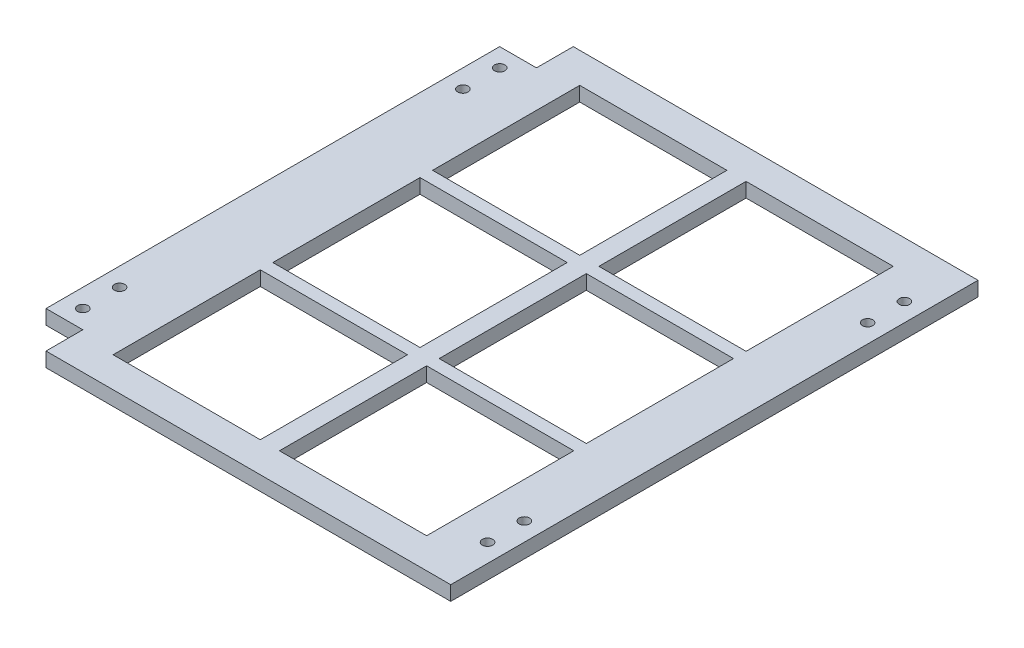
from build123d import *

# Parameters (mm, degrees)
SKETCH1_W                 = 279.4
SKETCH1_H                 = 364
BOSS_EXTRUDE1_DEPTH       = 10
SKETCH2_W                 = 101.6
SKETCH2_H                 = 101.6
CUT_EXTRUDE1_DEPTH        = 230.652106457
LPATTERN1_COUNT           = 2
LPATTERN1_PITCH           = 110.265
LPATTERN2_COUNT           = 2
LPATTERN2_PITCH           = 110.265
LPATTERN3_COUNT           = 2
LPATTERN3_PITCH           = 114.82
LPATTERN3_COPY_1_SKETCH_W = 101.6
LPATTERN3_COPY_1_SKETCH_H = 101.6
LPATTERN3_COPY_1_DEPTH    = 230.652106457
LPATTERN3_COPY_2_SKETCH_W = 101.6
LPATTERN3_COPY_2_SKETCH_H = 101.6
LPATTERN3_COPY_2_DEPTH    = 230.652106457
SKETCH3_W                 = 313.16
SKETCH3_H                 = 10
BOSS_EXTRUDE2_DEPTH       = 25.4
SKETCH4_R                 = 3.5687
CUT_EXTRUDE2_DEPTH        = 10


with BuildPart() as part:
    # Sketch1 → Boss-Extrude1 (new body)
    with BuildSketch(Plane(origin=(0, 0, 0), x_dir=(1, 0, 0), z_dir=(0, 1, 0))):
        Rectangle(SKETCH1_W, SKETCH1_H)
    extrude(amount=BOSS_EXTRUDE1_DEPTH)

    # Sketch2 → Cut-Extrude1 (cut, through all)
    with BuildSketch(Plane(origin=(0, 10, 0), x_dir=(1, 0, 0), z_dir=(0, 1, 0))):
        with Locations((-63.5, 0)):
            Rectangle(SKETCH2_W, SKETCH2_H)
    cut_extrude1 = extrude(amount=-CUT_EXTRUDE1_DEPTH, mode=Mode.SUBTRACT)

    # LPattern1: Cut-Extrude1 ×2
    with Locations(*[(0, 0, -i * LPATTERN1_PITCH) for i in range(1, LPATTERN1_COUNT)]):
        add(cut_extrude1, mode=Mode.SUBTRACT)

    # LPattern2: Cut-Extrude1 ×2
    with Locations(*[(0, 0, i * LPATTERN2_PITCH) for i in range(1, LPATTERN2_COUNT)]):
        add(cut_extrude1, mode=Mode.SUBTRACT)

    # LPattern3: Cut-Extrude1 ×2
    with Locations(*[(i * LPATTERN3_PITCH, 0, 0) for i in range(1, LPATTERN3_COUNT)]):
        add(cut_extrude1, mode=Mode.SUBTRACT)

    # LPattern3 copy 1 sketch → LPattern3 copy 1 (cut, through all)
    with BuildSketch(Plane(origin=(114.82, 10, -110.265), x_dir=(1, 0, 0), z_dir=(0, 1, 0))):
        with Locations((-63.5, 0)):
            Rectangle(LPATTERN3_COPY_1_SKETCH_W, LPATTERN3_COPY_1_SKETCH_H)
    extrude(amount=-LPATTERN3_COPY_1_DEPTH, mode=Mode.SUBTRACT)

    # LPattern3 copy 2 sketch → LPattern3 copy 2 (cut, through all)
    with BuildSketch(Plane(origin=(114.82, 10, 110.265), x_dir=(1, 0, 0), z_dir=(0, 1, 0))):
        with Locations((-63.5, 0)):
            Rectangle(LPATTERN3_COPY_2_SKETCH_W, LPATTERN3_COPY_2_SKETCH_H)
    extrude(amount=-LPATTERN3_COPY_2_DEPTH, mode=Mode.SUBTRACT)

    # Sketch3 → Boss-Extrude2 (add)
    with BuildSketch(Plane.ZY.offset(139.7)):
        with Locations((0, 5)):
            Rectangle(SKETCH3_W, SKETCH3_H)
    extrude(amount=BOSS_EXTRUDE2_DEPTH)

    # Sketch4 → Cut-Extrude2 (cut)
    with BuildSketch(Plane.XZ):
        with Locations(Location((127.00134615, -118.505273154, 0), (0, 0, 270))):
            Circle(SKETCH4_R)
        with Locations(Location((127.00134615, -143.905273154, 0), (0, 0, 270))):
            Circle(SKETCH4_R)
        with Locations(Location((-152.4, -118.505273154, 0), (0, 0, 270))):
            Circle(SKETCH4_R)
        with Locations(Location((-152.4, -143.905273154, 0), (0, 0, 270))):
            Circle(SKETCH4_R)
    cut_extrude2 = extrude(amount=-CUT_EXTRUDE2_DEPTH, mode=Mode.SUBTRACT)

    # Mirror1: Cut-Extrude2 across plane
    add(cut_extrude2.mirror(Plane.XY), mode=Mode.SUBTRACT)


solid = part.part
